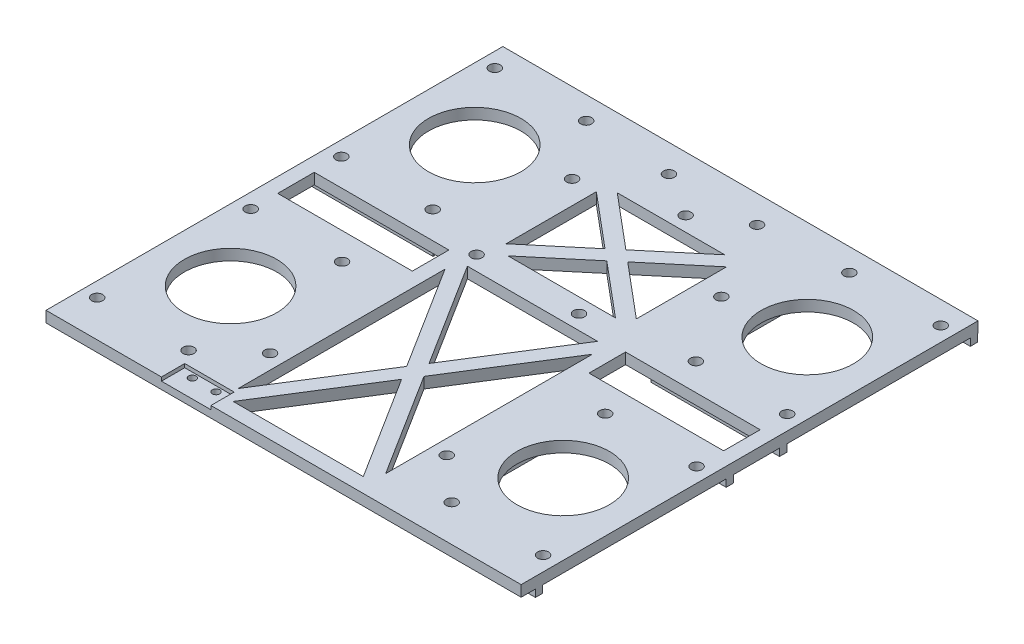
from build123d import *

# Parameters (mm, degrees)
SKETCH1_W                 = 130
SKETCH1_H                 = 125
BOSS_EXTRUDE1_DEPTH       = 5
SKETCH2_R                 = 1.5
SKETCH2_R_2               = 12.65
CUT_EXTRUDE1_DEPTH        = 10
SKETCH4_R                 = 1.5
CUT_EXTRUDE3_DEPTH        = 10
BOSS_EXTRUDE2_DEPTH       = 2
MIRROR7_COPY_1_SKETCH_R   = 1.5
MIRROR7_COPY_1_SKETCH_R_2 = 12.65
MIRROR7_COPY_1_DEPTH      = 10
MIRROR7_COPY_2_DEPTH      = 2
SKETCH10_R                = 1.5
CUT_EXTRUDE8_DEPTH        = 91.311959341
SKETCH11_R                = 2.65
CUT_EXTRUDE9_DEPTH        = 0.5
CUT_EXTRUDE10_DEPTH       = 91.444734507
CUT_EXTRUDE11_DEPTH       = 91.444734507
CUT_EXTRUDE12_DEPTH       = 91.444734507
SKETCH15_W                = 130
SKETCH15_H                = 125
SKETCH15_W_2              = 5
SKETCH15_H_2              = 5
CUT_EXTRUDE14_DEPTH       = 2
CUT_EXTRUDE15_START       = -8
SKETCH17_W                = 137.629855092
SKETCH17_H                = 131.076052468
CUT_EXTRUDE15_DEPTH       = 2
SKETCH18_W                = 13.527386212
SKETCH18_H                = 6.370278614
CUT_EXTRUDE16_DEPTH       = 1
SKETCH19_R                = 1
CUT_EXTRUDE17_DEPTH       = 5
SKETCH20_W                = 6.657761804
SKETCH20_H                = 4.4233075
CUT_EXTRUDE18_DEPTH       = 2


with BuildPart() as part:
    # Sketch1 → Boss-Extrude1 (new body)
    with BuildSketch(Plane(origin=(0, 0, 0), x_dir=(1, 0, 0), z_dir=(0, 1, 0))):
        Rectangle(SKETCH1_W, SKETCH1_H)
    extrude(amount=BOSS_EXTRUDE1_DEPTH)

    # Sketch2 → Cut-Extrude1 (cut)
    with BuildSketch(Plane(origin=(0, 5, 0), x_dir=(1, 0, 0), z_dir=(0, 1, 0))):
        with Locations(Location((-61, -52.5, 0), (0, 0, 270))):
            Circle(SKETCH2_R)
        with Locations(Location((-36, -52.5, 0), (0, 0, 270))):
            Circle(SKETCH2_R)
        with Locations(Location((-36, -10.5, 0), (0, 0, 270))):
            Circle(SKETCH2_R)
        with Locations(Location((-61, -10.5, 0), (0, 0, 270))):
            Circle(SKETCH2_R)
        with Locations(Location((-45.5, -31.5, 0), (0, 0, 270))):
            Circle(SKETCH2_R_2)
    cut_extrude1 = extrude(amount=-CUT_EXTRUDE1_DEPTH, mode=Mode.SUBTRACT)

    # Mirror3: Cut-Extrude1 across plane
    add(cut_extrude1.mirror(Plane.ZY), mode=Mode.SUBTRACT)

    # Sketch4 → Cut-Extrude3 (cut)
    with BuildSketch(Plane(origin=(0, 5, 0), x_dir=(1, 0, 0), z_dir=(0, 1, 0))):
        with Locations(Location((0, 47.5, 0), (0, 0, 270))):
            Circle(SKETCH4_R)
        with Locations(Location((12.049810205, 55, 0), (0, 0, 270))):
            Circle(SKETCH4_R)
        with Locations(Location((-12.049810205, 55, 0), (0, 0, 270))):
            Circle(SKETCH4_R)
    extrude(amount=-CUT_EXTRUDE3_DEPTH, mode=Mode.SUBTRACT)

    # Sketch5 → Boss-Extrude2 (add)
    with BuildSketch(Plane.XZ):
        Polygon((-65, 58.6), (-65, 56.6), (-31.8, 56.6), (-31.8, 6.4), (-65, 6.4), (-65, 4.4), (-29.8, 4.4), (-29.8, 58.6), align=None)
    boss_extrude2 = extrude(amount=BOSS_EXTRUDE2_DEPTH)

    # Mirror5: Boss-Extrude2 across plane
    add(boss_extrude2.mirror(Plane.ZY))

    # Mirror7: Cut-Extrude1, Boss-Extrude2 across plane
    add(cut_extrude1.mirror(Plane.XY.offset(-1.9)), mode=Mode.SUBTRACT)
    add(boss_extrude2.mirror(Plane.XY.offset(-1.9)))

    # Mirror7 copy 1 sketch → Mirror7 copy 1 (cut)
    with BuildSketch(Plane(origin=(0, 5, -3.8), x_dir=(-1, 0, 0), z_dir=(0, 1, 0))):
        with Locations(Location((-61, -52.5, 0), (0, 0, 270))):
            Circle(MIRROR7_COPY_1_SKETCH_R)
        with Locations(Location((-36, -52.5, 0), (0, 0, 270))):
            Circle(MIRROR7_COPY_1_SKETCH_R)
        with Locations(Location((-36, -10.5, 0), (0, 0, 270))):
            Circle(MIRROR7_COPY_1_SKETCH_R)
        with Locations(Location((-61, -10.5, 0), (0, 0, 270))):
            Circle(MIRROR7_COPY_1_SKETCH_R)
        with Locations(Location((-45.5, -31.5, 0), (0, 0, 270))):
            Circle(MIRROR7_COPY_1_SKETCH_R_2)
    extrude(amount=-MIRROR7_COPY_1_DEPTH, mode=Mode.SUBTRACT)

    # Mirror7 copy 2 sketch → Mirror7 copy 2 (add)
    with BuildSketch(Plane(origin=(0, 0, -3.8), x_dir=(-1, 0, 0), z_dir=(0, -1, 0))):
        Polygon((-65, 58.6), (-65, 56.6), (-31.8, 56.6), (-31.8, 6.4), (-65, 6.4), (-65, 4.4), (-29.8, 4.4), (-29.8, 58.6), align=None)
    extrude(amount=MIRROR7_COPY_2_DEPTH)

    # Sketch10 → Cut-Extrude8 (cut, through all)
    with BuildSketch(Plane(origin=(0, 0, 0), x_dir=(-1, 0, 0), z_dir=(0, -1, 0))):
        with Locations(Location((-24.17, -42.03, 0), (0, 0, 90))):
            Circle(SKETCH10_R)
        with Locations(Location((24.17, -42.03, 0), (0, 0, 90))):
            Circle(SKETCH10_R)
        with Locations(Location((-8.73, 9.6, 0), (0, 0, 90))):
            Circle(SKETCH10_R)
        with Locations(Location((19.29, 9.6, 0), (0, 0, 90))):
            Circle(SKETCH10_R)
        with Locations(Location((-24.17, 33.11, 0), (0, 0, 90))):
            Circle(SKETCH10_R)
        with Locations(Location((24.17, 40.6, 0), (0, 0, 90))):
            Circle(SKETCH10_R)
    extrude(amount=-CUT_EXTRUDE8_DEPTH, mode=Mode.SUBTRACT)

    # Sketch11 → Cut-Extrude9 (cut)
    with BuildSketch(Plane.XZ):
        with Locations(Location((-12.049810205, -55, 0), (0, 0, 270))):
            Circle(SKETCH11_R)
        with Locations(Location((0, -47.5, 0), (0, 0, 270))):
            Circle(SKETCH11_R)
        with Locations(Location((12.049810205, -55, 0), (0, 0, 270))):
            Circle(SKETCH11_R)
        with Locations(Location((-24.17, -40.6, 0), (0, 0, 270))):
            Circle(SKETCH11_R)
        with Locations(Location((24.17, -33.11, 0), (0, 0, 270))):
            Circle(SKETCH11_R)
        with Locations(Location((8.73, -9.6, 0), (0, 0, 270))):
            Circle(SKETCH11_R)
        with Locations(Location((-19.29, -9.6, 0), (0, 0, 270))):
            Circle(SKETCH11_R)
        with Locations(Location((-24.17, 42.03, 0), (0, 0, 270))):
            Circle(SKETCH11_R)
        with Locations(Location((24.17, 42.03, 0), (0, 0, 270))):
            Circle(SKETCH11_R)
        with Locations(Location((-61, -14.3, 0), (0, 0, 270))):
            Circle(SKETCH11_R)
        with Locations(Location((-36, -14.3, 0), (0, 0, 270))):
            Circle(SKETCH11_R)
        with Locations(Location((-61, -56.3, 0), (0, 0, 270))):
            Circle(SKETCH11_R)
        with Locations(Location((-36, -56.3, 0), (0, 0, 270))):
            Circle(SKETCH11_R)
        with Locations(Location((36, -56.3, 0), (0, 0, 270))):
            Circle(SKETCH11_R)
        with Locations(Location((61, -56.3, 0), (0, 0, 270))):
            Circle(SKETCH11_R)
        with Locations(Location((36, -14.3, 0), (0, 0, 270))):
            Circle(SKETCH11_R)
        with Locations(Location((61, -14.3, 0), (0, 0, 270))):
            Circle(SKETCH11_R)
        with Locations(Location((36, 10.5, 0), (0, 0, 270))):
            Circle(SKETCH11_R)
        with Locations(Location((61, 10.5, 0), (0, 0, 270))):
            Circle(SKETCH11_R)
        with Locations(Location((61, 52.5, 0), (0, 0, 270))):
            Circle(SKETCH11_R)
        with Locations(Location((36, 52.5, 0), (0, 0, 270))):
            Circle(SKETCH11_R)
        with Locations(Location((-36, 52.5, 0), (0, 0, 270))):
            Circle(SKETCH11_R)
        with Locations(Location((-36, 10.5, 0), (0, 0, 270))):
            Circle(SKETCH11_R)
        with Locations(Location((-61, 10.5, 0), (0, 0, 270))):
            Circle(SKETCH11_R)
        with Locations(Location((-61, 52.5, 0), (0, 0, 270))):
            Circle(SKETCH11_R)
    extrude(amount=-CUT_EXTRUDE9_DEPTH, mode=Mode.SUBTRACT)

    # Sketch12 → Cut-Extrude10 (cut, through all)
    with BuildSketch(Plane(origin=(0, 5, 0), x_dir=(1, 0, 0), z_dir=(0, 1, 0))):
        Polygon((-2.363095604, -26.45), (-20.17, 1.845056316), (-20.17, -54.745056316), align=None)
        Polygon((17.806904396, 5.6), (-17.806904396, 5.6), (0, -22.695056316), align=None)
        Polygon((20.17, -54.745056316), (20.17, 1.845056316), (2.363095604, -26.45), align=None)
        Polygon((0, -30.204943684), (-17.806904396, -58.5), (17.806904396, -58.5), align=None)
    extrude(amount=-CUT_EXTRUDE10_DEPTH, mode=Mode.SUBTRACT)

    # Sketch13 → Cut-Extrude11 (cut, through all)
    with BuildSketch(Plane(origin=(0, 5, 0), x_dir=(1, 0, 0), z_dir=(0, 1, 0))):
        Polygon((-61, 1.9), (-61, -3.1), (-24.17, -3.1), (-24.17, 6.9), (-61, 6.9), align=None)
    cut_extrude11 = extrude(amount=-CUT_EXTRUDE11_DEPTH, mode=Mode.SUBTRACT)

    # Mirror9: Cut-Extrude11 across plane
    add(cut_extrude11.mirror(Plane.ZY), mode=Mode.SUBTRACT)

    # Sketch14 → Cut-Extrude12 (cut, through all)
    with BuildSketch(Plane(origin=(0, 5, 0), x_dir=(1, 0, 0), z_dir=(0, 1, 0))):
        Polygon((-3.110442245, 28.55), (-17.806904396, 40.888590935), (-17.806904396, 16.211409065), align=None)
        Polygon((14.696462151, 43.5), (-14.696462151, 43.5), (0, 31.161409065), align=None)
        Polygon((17.806904396, 16.211409065), (17.806904396, 40.888590935), (3.110442245, 28.55), align=None)
        Polygon((0, 25.938590935), (-14.696462151, 13.6), (14.696462151, 13.6), align=None)
    extrude(amount=-CUT_EXTRUDE12_DEPTH, mode=Mode.SUBTRACT)

    # Sketch15 → Cut-Extrude14 (cut)
    with BuildSketch(Plane(origin=(0, 5, 0), x_dir=(1, 0, 0), z_dir=(0, 1, 0))):
        Rectangle(SKETCH15_W, SKETCH15_H)
        with Locations((-61, 56.3)):
            Rectangle(SKETCH15_W_2, SKETCH15_H_2, mode=Mode.SUBTRACT)
        with Locations((-36, 56.3)):
            Rectangle(SKETCH15_W_2, SKETCH15_H_2, mode=Mode.SUBTRACT)
        with Locations((-12.049810205, 55)):
            Rectangle(SKETCH15_W_2, SKETCH15_H_2, mode=Mode.SUBTRACT)
        with Locations((0, 47.5)):
            Rectangle(SKETCH15_W_2, SKETCH15_H_2, mode=Mode.SUBTRACT)
        with Locations((12.049810205, 55)):
            Rectangle(SKETCH15_W_2, SKETCH15_H_2, mode=Mode.SUBTRACT)
        with Locations((36, 56.3)):
            Rectangle(SKETCH15_W_2, SKETCH15_H_2, mode=Mode.SUBTRACT)
        with Locations((61, 56.3)):
            Rectangle(SKETCH15_W_2, SKETCH15_H_2, mode=Mode.SUBTRACT)
        with Locations((36, 14.3)):
            Rectangle(SKETCH15_W_2, SKETCH15_H_2, mode=Mode.SUBTRACT)
        with Locations((61, 14.3)):
            Rectangle(SKETCH15_W_2, SKETCH15_H_2, mode=Mode.SUBTRACT)
        with Locations((24.17, 33.11)):
            Rectangle(SKETCH15_W_2, SKETCH15_H_2, mode=Mode.SUBTRACT)
        with Locations((36, -10.5)):
            Rectangle(SKETCH15_W_2, SKETCH15_H_2, mode=Mode.SUBTRACT)
        with Locations((61, -10.5)):
            Rectangle(SKETCH15_W_2, SKETCH15_H_2, mode=Mode.SUBTRACT)
        with Locations((24.17, -42.03)):
            Rectangle(SKETCH15_W_2, SKETCH15_H_2, mode=Mode.SUBTRACT)
        with Locations((36, -52.5)):
            Rectangle(SKETCH15_W_2, SKETCH15_H_2, mode=Mode.SUBTRACT)
        with Locations((61, -52.5)):
            Rectangle(SKETCH15_W_2, SKETCH15_H_2, mode=Mode.SUBTRACT)
        with Locations((-24.17, -42.03)):
            Rectangle(SKETCH15_W_2, SKETCH15_H_2, mode=Mode.SUBTRACT)
        with Locations((-36, -52.5)):
            Rectangle(SKETCH15_W_2, SKETCH15_H_2, mode=Mode.SUBTRACT)
        with Locations((-36, -10.5)):
            Rectangle(SKETCH15_W_2, SKETCH15_H_2, mode=Mode.SUBTRACT)
        with Locations((8.73, 9.6)):
            Rectangle(SKETCH15_W_2, SKETCH15_H_2, mode=Mode.SUBTRACT)
        with Locations((-19.29, 9.6)):
            Rectangle(SKETCH15_W_2, SKETCH15_H_2, mode=Mode.SUBTRACT)
        with Locations((-24.17, 40.6)):
            Rectangle(SKETCH15_W_2, SKETCH15_H_2, mode=Mode.SUBTRACT)
        with Locations((-61, 14.3)):
            Rectangle(SKETCH15_W_2, SKETCH15_H_2, mode=Mode.SUBTRACT)
        with Locations((-36, 14.3)):
            Rectangle(SKETCH15_W_2, SKETCH15_H_2, mode=Mode.SUBTRACT)
        with Locations((-61, -10.5)):
            Rectangle(SKETCH15_W_2, SKETCH15_H_2, mode=Mode.SUBTRACT)
        with Locations((-61, -52.5)):
            Rectangle(SKETCH15_W_2, SKETCH15_H_2, mode=Mode.SUBTRACT)
    extrude(amount=-CUT_EXTRUDE14_DEPTH, mode=Mode.SUBTRACT)

    # Sketch17 → Cut-Extrude15 (cut)
    with BuildSketch(Plane(origin=(0, 13, 0), x_dir=(1, 0, 0), z_dir=(0, 1, 0)).offset(CUT_EXTRUDE15_START)):
        with Locations((0.756207995, -1.260346658)):
            Rectangle(SKETCH17_W, SKETCH17_H)
    extrude(amount=-CUT_EXTRUDE15_DEPTH, mode=Mode.SUBTRACT)

    # Sketch18 → Cut-Extrude16 (cut)
    with BuildSketch(Plane(origin=(0, 3, 0), x_dir=(1, 0, 0), z_dir=(0, 1, 0))):
        with Locations((-26.648289701, -59.314860693)):
            Rectangle(SKETCH18_W, SKETCH18_H)
    extrude(amount=-CUT_EXTRUDE16_DEPTH, mode=Mode.SUBTRACT)

    # Sketch19 → Cut-Extrude17 (cut)
    with BuildSketch(Plane(origin=(0, 2, 0), x_dir=(1, 0, 0), z_dir=(0, 1, 0))):
        with Locations(Location((-23.4201, -57.55, 0), (0, 0, 270))):
            Circle(SKETCH19_R)
        with Locations(Location((-29.9201, -57.55, 0), (0, 0, 270))):
            Circle(SKETCH19_R)
    extrude(amount=-CUT_EXTRUDE17_DEPTH, mode=Mode.SUBTRACT)

    # Sketch20 → Cut-Extrude18 (cut)
    with BuildSketch(Plane.XZ):
        with Locations((-29.482363252, 57.493891291)):
            Rectangle(SKETCH20_W, SKETCH20_H)
    extrude(amount=CUT_EXTRUDE18_DEPTH, mode=Mode.SUBTRACT)


solid = part.part
